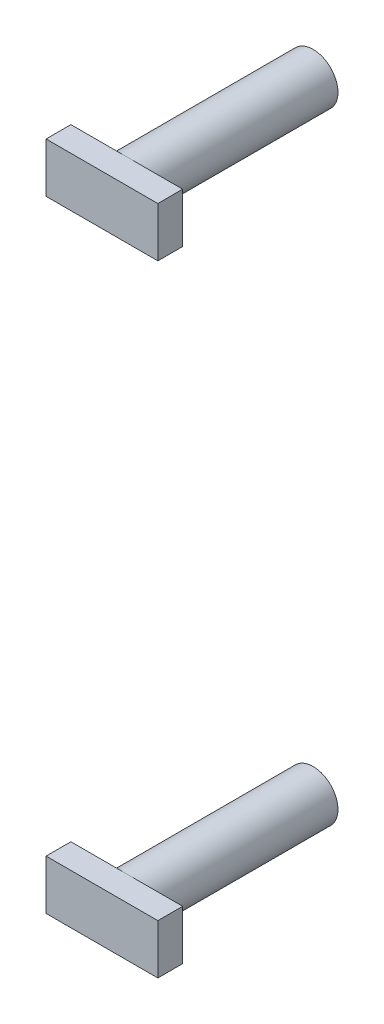
from build123d import *

# Parameters (mm, degrees)
SKETCH1_R             = 2
BOSS_EXTRUDE1_DEPTH   = 15
BOSS_EXTRUDE1_2_DEPTH = 15
SKETCH1_3_W           = 9
SKETCH1_3_H           = 4
BOSS_EXTRUDE2_DEPTH   = 2


with BuildPart() as part:
    # Sketch1 → Boss-Extrude1 (new body)
    with BuildSketch(Plane.XY):
        with Locations((19, -25)):
            Circle(SKETCH1_R)
    extrude(amount=-BOSS_EXTRUDE1_DEPTH)



with BuildPart() as body_2:
    # Sketch1 → Boss-Extrude1 2 (new body)
    with BuildSketch(Plane.XY):
        with Locations((19, 25)):
            Circle(SKETCH1_R)
    extrude(amount=-BOSS_EXTRUDE1_2_DEPTH)


with BuildPart() as part_1:
    add(part.part)

    add(body_2.part)  # Boss-Extrude2 merges body 2
    # Sketch1<3> → Boss-Extrude2 (add)
    with BuildSketch(Plane.XY):
        with Locations((19, -25)):
            Rectangle(SKETCH1_3_W, SKETCH1_3_H)
        with Locations((19, 25)):
            Rectangle(SKETCH1_3_W, SKETCH1_3_H)
    extrude(amount=BOSS_EXTRUDE2_DEPTH)


solid = part_1.part
